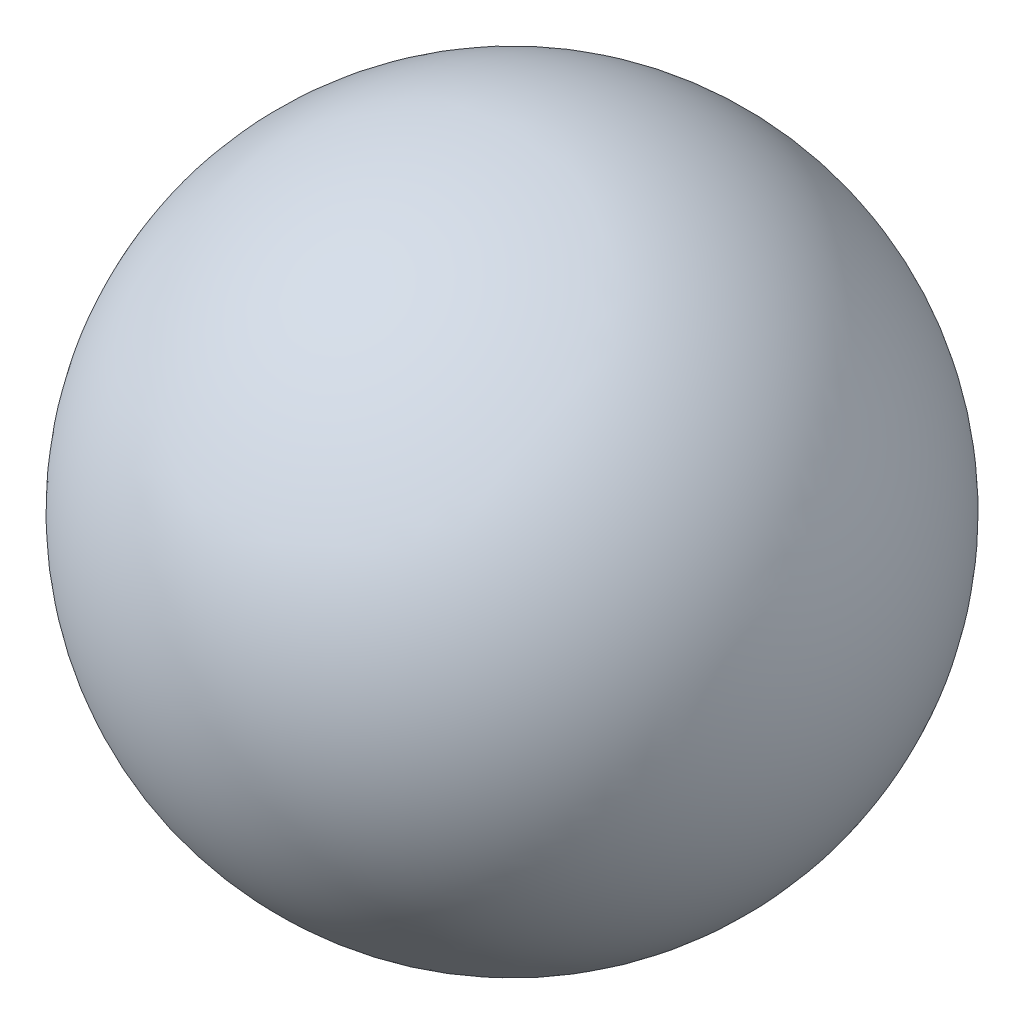
from build123d import *


with BuildPart() as part:
    # Schizzo1 → Rivoluzione1 (revolve)
    with BuildSketch(Plane.XY):
        with BuildLine():
            Line((-3.979939812, 0.400098849), (3.979939812, -0.400098849))
            ThreePointArc((3.979939812, -0.400098849), (0.400098849, 3.979939812), (-3.979939812, 0.400098849))
        make_face()
    revolve(axis=Axis((-3.979939812, 0.400098849, 0), (0.994984953119392, -0.100024712276524, 0)))


solid = part.part
